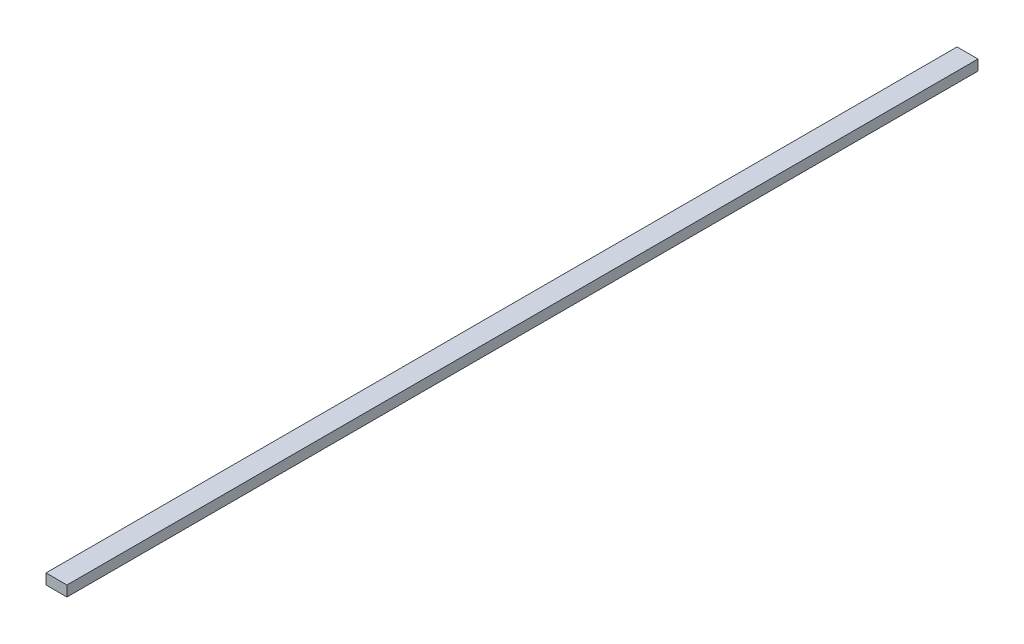
from build123d import *

# Parameters (mm, degrees)
SKETCH1_W           = 25.4
SKETCH1_H           = 1104.9
BOSS_EXTRUDE1_DEPTH = 12.7


with BuildPart() as part:
    # Sketch1 → Boss-Extrude1 (new body)
    with BuildSketch(Plane(origin=(0, 0, 0), x_dir=(1, 0, 0), z_dir=(0, 1, 0))):
        with Locations((12.7, 552.45)):
            Rectangle(SKETCH1_W, SKETCH1_H)
    extrude(amount=BOSS_EXTRUDE1_DEPTH)


solid = part.part
